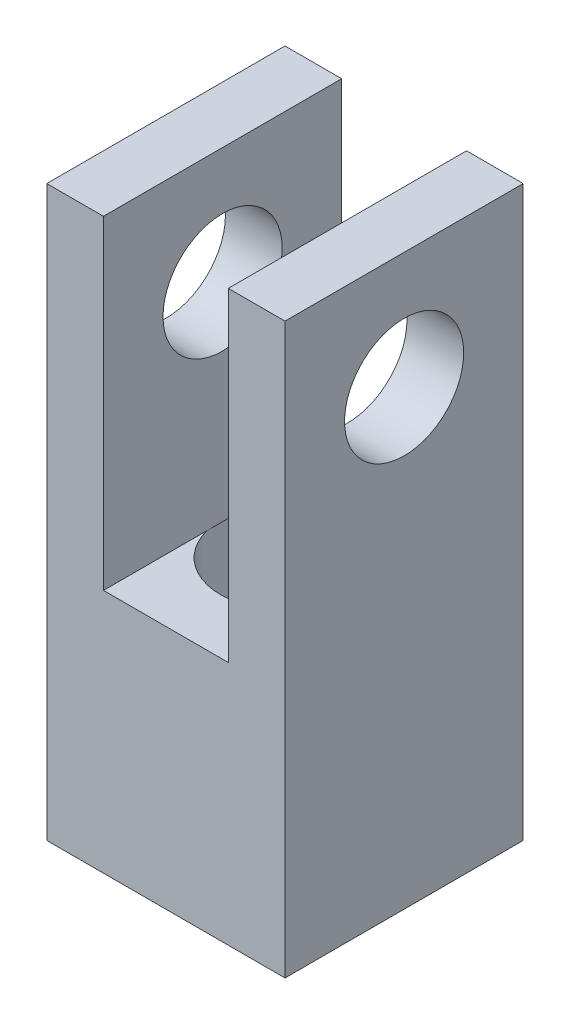
from build123d import *

# Parameters (mm, degrees)
SKETCH1_W           = 12.7
SKETCH1_H           = 12.7
BOSS_EXTRUDE1_DEPTH = 30.3276
SKETCH2_W           = 6.6548
SKETCH2_H           = 12.7
CUT_EXTRUDE1_DEPTH  = 17.272
SKETCH3_R           = 3.175
CUT_EXTRUDE2_DEPTH  = 34.486950022
SKETCH4_R           = 3.429
CUT_EXTRUDE3_DEPTH  = 13.0556


with BuildPart() as part:
    # Sketch1 → Boss-Extrude1 (new body)
    with BuildSketch(Plane(origin=(0, 0, 0), x_dir=(1, 0, 0), z_dir=(0, 1, 0))):
        Rectangle(SKETCH1_W, SKETCH1_H)
    extrude(amount=BOSS_EXTRUDE1_DEPTH)

    # Sketch2 → Cut-Extrude1 (cut)
    with BuildSketch(Plane(origin=(0, 30.3276, 0), x_dir=(1, 0, 0), z_dir=(0, 1, 0))):
        Rectangle(SKETCH2_W, SKETCH2_H)
    extrude(amount=-CUT_EXTRUDE1_DEPTH, mode=Mode.SUBTRACT)

    # Sketch3 → Cut-Extrude2 (cut, through all)
    with BuildSketch(Plane(origin=(6.35, 0, 0), x_dir=(0, 0, -1), z_dir=(1, 0, 0))):
        with Locations((0, 24.1046)):
            Circle(SKETCH3_R)
    extrude(amount=-CUT_EXTRUDE2_DEPTH, mode=Mode.SUBTRACT)

    # Sketch4 → Cut-Extrude3 (cut)
    with BuildSketch(Plane.XZ):
        with Locations(Location((0, 0, 0), (0, 0, 270))):
            Circle(SKETCH4_R)
    extrude(amount=-CUT_EXTRUDE3_DEPTH, mode=Mode.SUBTRACT)


solid = part.part
